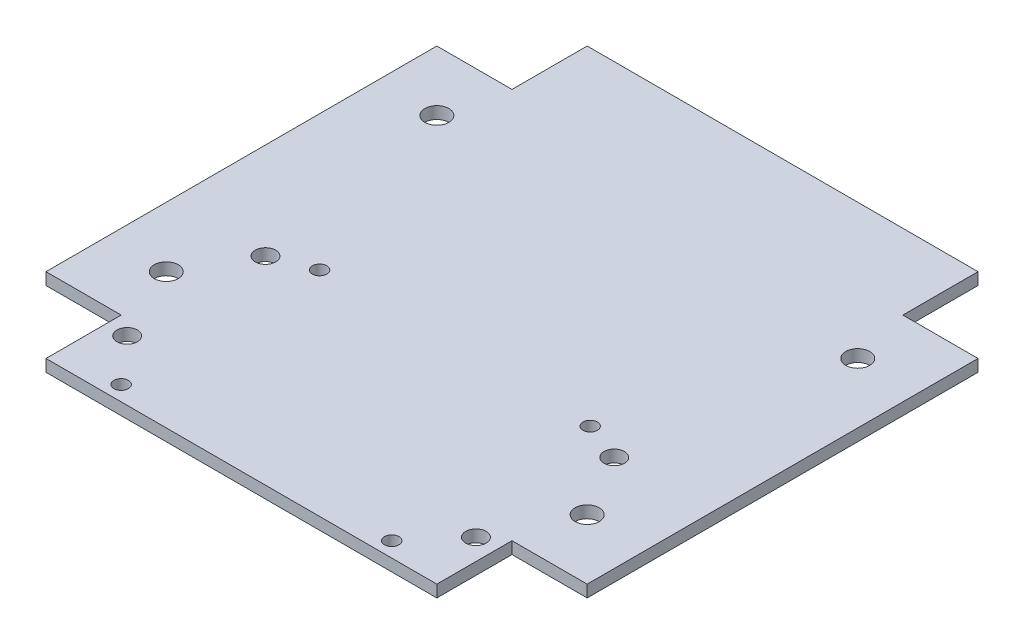
from build123d import *

# Parameters (mm, degrees)
BOSS_EXTRUDE1_DEPTH      = 2
F_4_0MM_DOWEL_HOLE1_D    = 4
M3_CLEARANCE_HOLE1_D     = 3.4
M3_CLEARANCE_HOLE1_DEPTH = 10
M3_CLEARANCE_HOLE1_TIP   = 1.021463052
M2_CLEARANCE_HOLE1_D     = 2.4
M2_CLEARANCE_HOLE1_DEPTH = 10
M2_CLEARANCE_HOLE1_TIP   = 0.721032743


with BuildPart() as part:
    # Sketch1 → Boss-Extrude1 (new body)
    with BuildSketch(Plane(origin=(0, 0, 0), x_dir=(1, 0, 0), z_dir=(0, 1, 0))):
        Polygon((-53.970588235, 35.110294118), (-41.470588235, 35.110294118), (-41.470588235, 47.610294118), (23.529411765, 47.610294118), (23.529411765, 35.110294118), (36.029411765, 35.110294118), (36.029411765, -29.889705882), (23.529411765, -29.889705882), (23.529411765, -42.389705882), (-41.470588235, -42.389705882), (-41.470588235, -29.889705882), (-53.970588235, -29.889705882), align=None)
    extrude(amount=BOSS_EXTRUDE1_DEPTH)

    # Ø4.0mm Dowel Hole1 (through all)
    with Locations(Plane(origin=(0, 2, 0), x_dir=(1, 0, 0), z_dir=(0, 1, 0))):
        with Locations((-43.970588235, 25.110294118), (26.029411765, 25.110294118), (-43.970588235, -19.889705882), (26.029411765, -19.889705882)):
            Hole(F_4_0MM_DOWEL_HOLE1_D / 2)

    # M3 Clearance Hole1
    with Locations(Plane(origin=(0, 2, 0), x_dir=(1, 0, 0), z_dir=(0, 1, 0))):
        with Locations((-37.970588235, -9.389705882), (-37.970588235, -32.389705882), (20.029411765, -32.389705882), (20.029411765, -9.389705882)):
            Hole(M3_CLEARANCE_HOLE1_D / 2, depth=M3_CLEARANCE_HOLE1_DEPTH)
            with Locations((0, 0, -(M3_CLEARANCE_HOLE1_DEPTH + M3_CLEARANCE_HOLE1_TIP / 2))):  # 118° drill point
                Cone(0, M3_CLEARANCE_HOLE1_D / 2, M3_CLEARANCE_HOLE1_TIP, mode=Mode.SUBTRACT)

    # M2 Clearance Hole1
    with Locations(Plane(origin=(0, 2, 0), x_dir=(1, 0, 0), z_dir=(0, 1, 0))):
        with Locations((-31.470588235, -39.889705882), (-31.470588235, -6.889705882), (13.529411765, -39.889705882), (13.529411765, -6.889705882)):
            Hole(M2_CLEARANCE_HOLE1_D / 2, depth=M2_CLEARANCE_HOLE1_DEPTH)
            with Locations((0, 0, -(M2_CLEARANCE_HOLE1_DEPTH + M2_CLEARANCE_HOLE1_TIP / 2))):  # 118° drill point
                Cone(0, M2_CLEARANCE_HOLE1_D / 2, M2_CLEARANCE_HOLE1_TIP, mode=Mode.SUBTRACT)


solid = part.part
